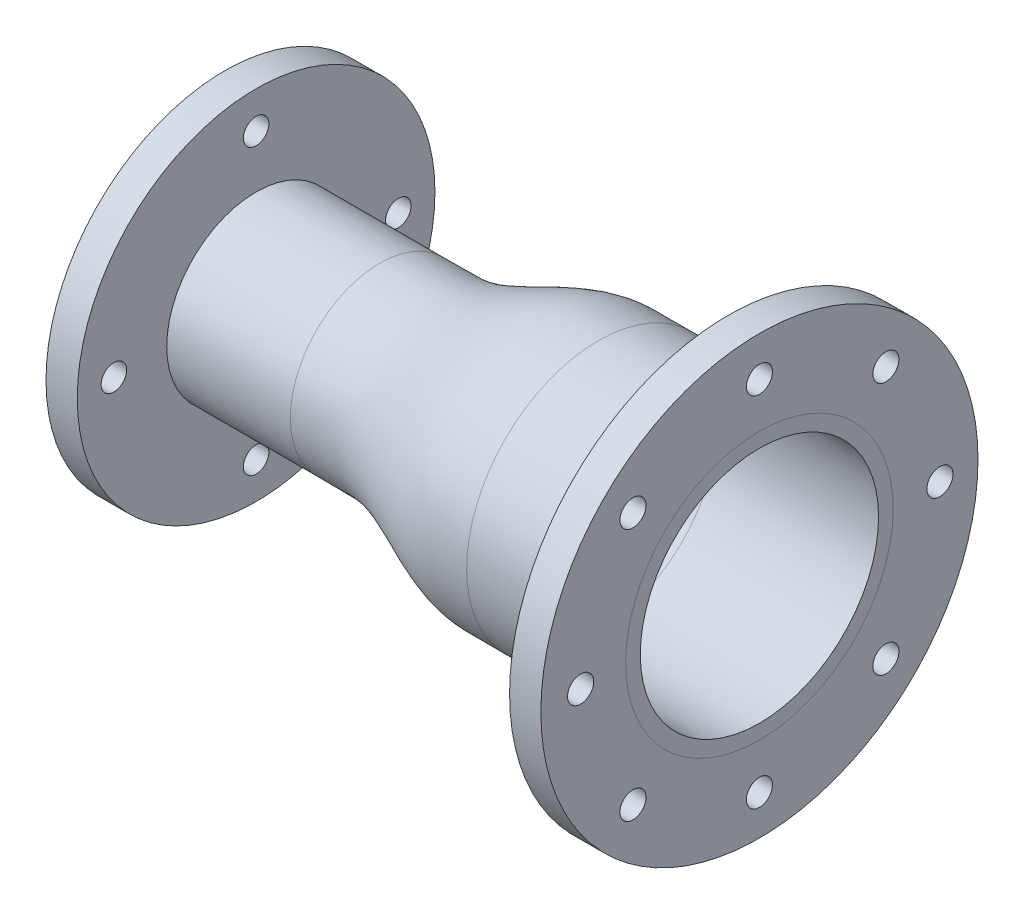
from build123d import *

# Parameters (mm, degrees)
CSK_FOR_5_8_FLAT_HEAD_MACHINE_SCREW_100_D           = 16.66748
CSK_FOR_5_8_FLAT_HEAD_MACHINE_SCREW_100_DEPTH       = 20
CSK_FOR_5_8_FLAT_HEAD_MACHINE_SCREW_100_CSINK_D     = 32.3088
CSK_FOR_5_8_FLAT_HEAD_MACHINE_SCREW_100_CSINK_ANGLE = 100
F_5_8_CLEARANCE_HOLE1_D                             = 16.27124
F_5_8_CLEARANCE_HOLE1_DEPTH                         = 20


with BuildPart() as part:
    # Sketch2 → Revolve1 (revolve)
    with BuildSketch(Plane.XY, mode=Mode.PRIVATE) as revolve1_sk:
        with BuildLine():
            Line((341.7, 76.137499212), (341.7, 139.7))
            Line((341.7, 139.7), (321.7, 139.7))
            Line((321.7, 139.7), (321.7, 84.137499212))
            Line((321.7, 84.137499212), (238.7, 84.137499212))
            add(Edge.make_bspline(
                [(238.7, 84.137499212), (238.355924075, 84.137499212), (237.667772223, 84.137499211), (236.43892963, 84.137499212), (234.866011112, 84.137499209), (233.096477778, 84.137499221), (231.179483334, 84.137499181), (229.409949997, 84.137499346), (227.492955565, 84.137498785), (225.723422181, 84.137501116), (223.806427909, 84.137493202), (222.03689386, 84.137526067), (220.119901847, 84.137414453), (218.350358415, 84.137877999), (216.436180482, 84.136306025), (214.671251811, 84.142808495), (212.761120781, 84.086749305), (210.997970421, 83.981894478), (209.088061418, 83.811610968), (207.325068085, 83.603702947), (205.415339805, 83.325577691), (203.652528826, 83.021476856), (201.742980231, 82.643054651), (199.980349522, 82.250081454), (198.070973132, 81.779589057), (196.308510241, 81.305636666), (194.399291637, 80.751921317), (192.636978054, 80.205434277), (190.727898375, 79.577923288), (188.965712472, 78.967858654), (187.056750607, 78.276511422), (185.294669761, 77.61229035), (183.385803915, 76.867540678), (181.623805854, 76.15899109), (179.715014471, 75.371680114), (177.95307795, 74.628970979), (176.044340155, 73.810271455), (174.28244512, 73.043839656), (172.373740784, 72.205172954), (170.611868192, 71.425644088), (168.701772289, 70.577967809), (166.937395899, 69.794959659), (165.024786727, 68.949453647), (163.259291454, 68.174390413), (161.346657228, 67.343861664), (159.58112861, 66.587981326), (157.668449277, 65.784003027), (155.902867536, 65.057899506), (153.990122343, 64.291832507), (152.22446654, 63.60586364), (150.311633974, 62.888769921), (148.545882008, 62.252980739), (146.632940071, 61.595543531), (144.867069113, 61.019596499), (142.95399603, 60.432048638), (141.187983586, 59.925161995), (139.274759098, 59.417223546), (137.508584813, 58.988118492), (135.595192141, 58.568944237), (133.828840435, 58.225800875), (131.915268777, 57.903938632), (130.148732425, 57.654357312), (128.234978669, 57.437727635), (126.468267149, 57.288649922), (124.789582716, 57.197477456), (123.443760708, 57.156958736), (122.420535806, 57.149027418), (121.677966993, 57.150148752), (120.601758891, 57.149831794), (119.202172332, 57.150049881), (117.285177742, 57.149983489), (115.515644452, 57.150003038), (113.598649997, 57.149998331), (111.829116667, 57.149999717), (109.912122221, 57.149999383), (108.142588888, 57.149999482), (106.225594444, 57.149999458), (104.45606111, 57.149999465), (102.539066666, 57.149999463), (101.039878703, 57.149999464), (99.81103611, 57.149999464), (99.27034537, 57.149999464), (98.999999999, 57.149999464)],
                knots=[0, 0, 0, 0, 0.007154165, 0.014308329, 0.025550588, 0.039858917, 0.051101176, 0.065409505, 0.076651764, 0.090960094, 0.102202352, 0.116510682, 0.12775294, 0.14206127, 0.153303528, 0.167554008, 0.178755429, 0.193030915, 0.204271905, 0.218620642, 0.229935227, 0.24439542, 0.255809505, 0.270408809, 0.281939941, 0.296695409, 0.308352907, 0.323271342, 0.335056718, 0.350135378, 0.362042998, 0.377270556, 0.389288475, 0.404646168, 0.416757099, 0.432220021, 0.44440238, 0.459940864, 0.472169892, 0.487750951, 0.499999862, 0.51562065, 0.52788688, 0.543480107, 0.55571106, 0.571242545, 0.583412274, 0.598850533, 0.610935794, 0.626253518, 0.638234915, 0.653410393, 0.66527347, 0.680291945, 0.692028204, 0.706883096, 0.718490902, 0.733184872, 0.744670204, 0.75921598, 0.770592966, 0.785013865, 0.796305044, 0.810635098, 0.821871343, 0.831256632, 0.838627865, 0.843146285, 0.846696472, 0.861004801, 0.87224706, 0.886555389, 0.897797648, 0.912105977, 0.923348236, 0.937656565, 0.948898824, 0.963207153, 0.974449412, 0.988757741, 0.994378871, 1, 1, 1, 1], degree=3, weights=[0.576132148, 0.576132148, 0.576132148, 0.576132148, 0.576132148, 0.576132148, 0.576132148, 0.576132148, 0.576132148, 0.576132148, 0.576132148, 0.576132148, 0.576132148, 0.576132148, 0.576132148, 0.576132148, 0.576132148, 0.576132148, 0.576132148, 0.576132148, 0.576132148, 0.576132148, 0.576132148, 0.576132148, 0.576132148, 0.576132148, 0.576132148, 0.576132148, 0.576132148, 0.576132148, 0.576132148, 0.576132148, 0.576132148, 0.576132148, 0.576132148, 0.576132148, 0.576132148, 0.576132148, 0.576132148, 0.576132148, 0.576132148, 0.576132148, 0.576132148, 0.576132148, 0.576132148, 0.576132148, 0.576132148, 0.576132148, 0.576132148, 0.576132148, 0.576132148, 0.576132148, 0.576132148, 0.576132148, 0.576132148, 0.576132148, 0.576132148, 0.576132148, 0.576132148, 0.576132148, 0.576132148, 0.576132148, 0.576132148, 0.576132148, 0.576132148, 0.576132148, 0.576132148, 0.576132148, 0.576132148, 0.576132148, 0.576132148, 0.576132148, 0.576132148, 0.576132148, 0.576132148, 0.576132148, 0.576132148, 0.576132148, 0.576132148, 0.576132148, 0.576132148, 0.576132148, 0.576132148]))
            Line((98.999999999, 57.149999464), (20, 57.149999464))
            Line((20, 57.149999464), (20, 114.3))
            Line((20, 114.3), (0, 114.3))
            Line((0, 114.3), (0, 49.149999464))
            Line((0, 49.149999464), (98.999999999, 49.149999464))
            add(Edge.make_bspline(
                [(238.700000001, 76.137499212), (235.69409428, 76.137499211), (231.185175342, 76.137529978), (225.92498116, 76.137458281), (222.918904328, 76.137568327), (220.664664612, 76.137283149), (218.784669959, 76.138023248), (217.290602157, 76.13677783), (216.128457097, 76.1382361), (215.066881493, 76.138852647), (213.792519107, 76.118938664), (211.496695076, 76.015652057), (208.229301379, 75.6893674), (204.270612611, 75.027164667), (200.298712296, 74.120693109), (194.985358164, 72.623109637), (188.321466773, 70.283294689), (180.275439823, 66.96143105), (172.126179657, 63.34551056), (163.790302615, 59.64532736), (155.164556548, 56.079333574), (147.64132386, 53.429737774), (141.378908996, 51.662061148), (136.556364248, 50.559794229), (131.615917341, 49.730227773), (127.403841781, 49.309288048), (124.437765649, 49.174559905), (122.930150126, 49.151400947), (122.100741829, 49.149426118), (121.356980871, 49.150399773), (120.417271001, 49.149754665), (118.913072261, 49.150117503), (117.035873074, 49.149952223), (114.780889972, 49.150013449), (111.775161973, 49.149990987), (106.514717734, 49.150005821), (102.005905795, 49.149999464), (98.999999999, 49.149999464)],
                knots=[0, 0, 0, 0, 0.0625, 0.09375, 0.109375, 0.125, 0.140625, 0.1484375, 0.15625, 0.1640625, 0.171875, 0.1875, 0.21875, 0.25, 0.28125, 0.3125, 0.375, 0.4375, 0.5, 0.5625, 0.625, 0.6875, 0.71875, 0.75, 0.78125, 0.8125, 0.828125, 0.8359375, 0.83984375, 0.84375, 0.8515625, 0.859375, 0.875, 0.890625, 0.90625, 0.9375, 1, 1, 1, 1], degree=3))
            Line((238.700000001, 76.137499212), (341.7, 76.137499212))
        make_face()
    revolve(revolve1_sk.sketch.rotate(Axis((341.7, 0, 0), (-1, 0, 0)), 90), axis=Axis((341.7, 0, 0), (-1, 0, 0)))

    # CSK for 5_8 Flat Head Machine Screw _100
    with Locations(Plane(origin=(321.7, -86.94526051, 61.229912904), x_dir=(0, 0, 1), z_dir=(-1, 0, 0))):
        with Locations((-61.229912904, 201.24526051), (-176.596487394, 86.94526051), (-142.052217993, 167.767565599), (19.592392186, 167.767565599), (53.070087096, 86.94526051), (19.592392186, 6.12295542), (-61.229912904, -27.406492985), (-142.052217993, 6.12295542)):
            CounterSinkHole(CSK_FOR_5_8_FLAT_HEAD_MACHINE_SCREW_100_D / 2, CSK_FOR_5_8_FLAT_HEAD_MACHINE_SCREW_100_CSINK_D / 2, depth=CSK_FOR_5_8_FLAT_HEAD_MACHINE_SCREW_100_DEPTH, counter_sink_angle=CSK_FOR_5_8_FLAT_HEAD_MACHINE_SCREW_100_CSINK_ANGLE)

    # 5/8 Clearance Hole1
    with Locations(Plane(origin=(0, -86.94526051, 61.229912904), x_dir=(0, 0, 1), z_dir=(-1, 0, 0))):
        with Locations((-61.229912904, 177.798020209), (29.681467244, 86.94526051), (-61.229912904, -3.966119638), (-152.141293051, 86.94526051)):
            Hole(F_5_8_CLEARANCE_HOLE1_D / 2, depth=F_5_8_CLEARANCE_HOLE1_DEPTH)


solid = part.part
